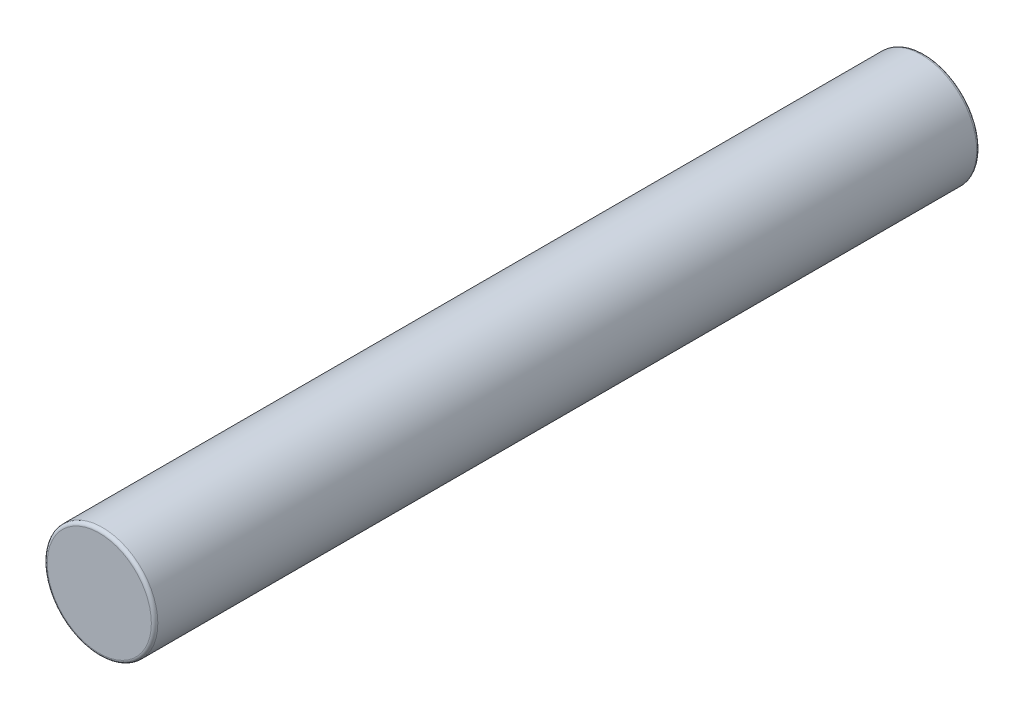
from build123d import *

# Parameters (mm, degrees)
SKETCH1_R           = 8.509
BOSS_EXTRUDE1_DEPTH = 127
FILLET1_R           = 0.5


with BuildPart() as part:
    # Sketch1 → Boss-Extrude1 (new body)
    with BuildSketch(Plane.XY):
        Circle(SKETCH1_R)
    extrude(amount=BOSS_EXTRUDE1_DEPTH)

    # Fillet1
    fillet1_edges = [part.edges().sort_by_distance(p)[0] for p in [
        (-8.509, 0, 0),
        (-8.509, 0, 127),
    ]]
    fillet(fillet1_edges, radius=FILLET1_R)


solid = part.part
